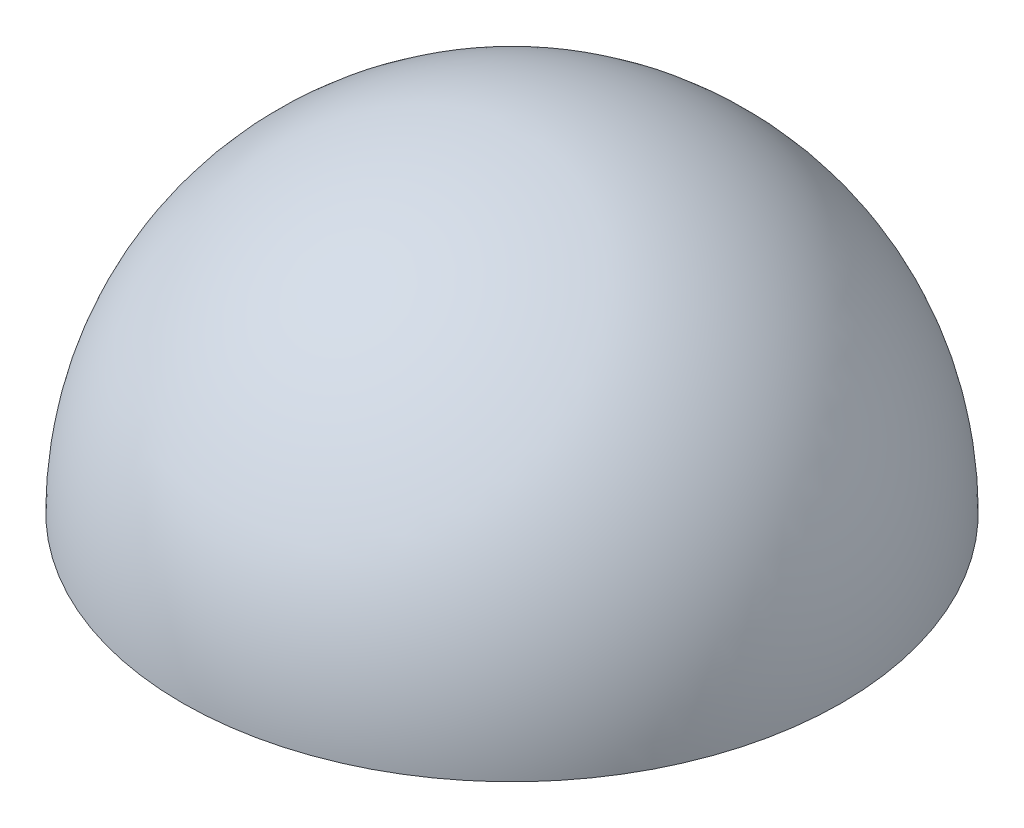
from build123d import *


with BuildPart() as part:
    # Sketch1 → Revolve1 (revolve)
    with BuildSketch(Plane.XY):
        with BuildLine():
            Line((0, 160), (0, 0))
            Line((0, 0), (160, 0))
            ThreePointArc((160, 0), (113.13708499, 113.13708499), (0, 160))
        make_face()
    revolve(axis=Axis((0, 0, 0), (0, 1, 0)))


solid = part.part
